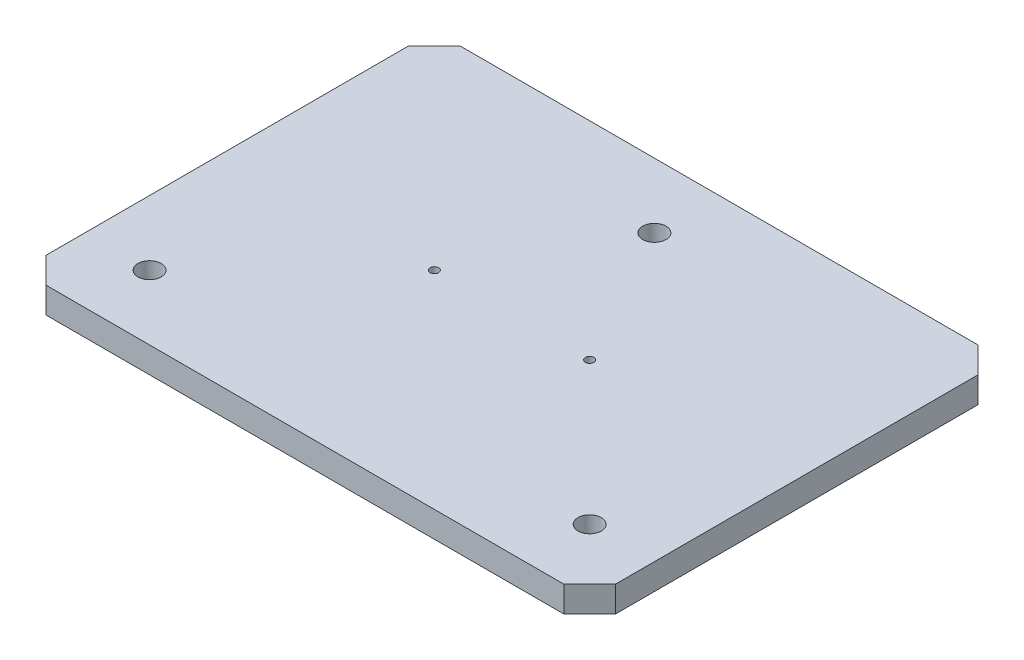
from build123d import *

# Parameters (mm, degrees)
SKETCH1_W              = 220
SKETCH1_H              = 160
BOSS_EXTRUDE1_DEPTH    = 10
CHAMFER1_SIZE          = 10
M10X1_0_TAPPED_HOLE1_D = 9
M4X0_7_TAPPED_HOLE1_D  = 3.3


with BuildPart() as part:
    # Sketch1 → Boss-Extrude1 (new body)
    with BuildSketch(Plane(origin=(0, 0, 0), x_dir=(1, 0, 0), z_dir=(0, 1, 0))):
        Rectangle(SKETCH1_W, SKETCH1_H)
    extrude(amount=BOSS_EXTRUDE1_DEPTH)

    # Chamfer1
    chamfer1_edges = [part.edges().sort_by_distance(p)[0] for p in [
        (-110, 5, -80),
        (110, 5, -80),
        (110, 5, 80),
        (-110, 5, 80),
    ]]
    chamfer(chamfer1_edges, length=CHAMFER1_SIZE)

    # M10x1.0 Tapped Hole1 (through all)
    with Locations(Plane(origin=(0, 10, -55), x_dir=(0, 0, 1), z_dir=(0, 1, 0))):
        with Locations((0, 0), (110, -85), (110, 85)):
            Hole(M10X1_0_TAPPED_HOLE1_D / 2)

    # M4x0.7 Tapped Hole1 (through all)
    with Locations(Plane(origin=(30, 10, 0), x_dir=(0, 0, 1), z_dir=(0, 1, 0))):
        with Locations((0, 0)):
            m4x0_7_tapped_hole1 = Hole(M4X0_7_TAPPED_HOLE1_D / 2)

    # Mirror1: M4x0.7 Tapped Hole1 across plane
    add(m4x0_7_tapped_hole1.mirror(Plane(origin=(0, 0, 0), x_dir=(0, 0, 1), z_dir=(1, 0, 0))), mode=Mode.SUBTRACT)


solid = part.part
